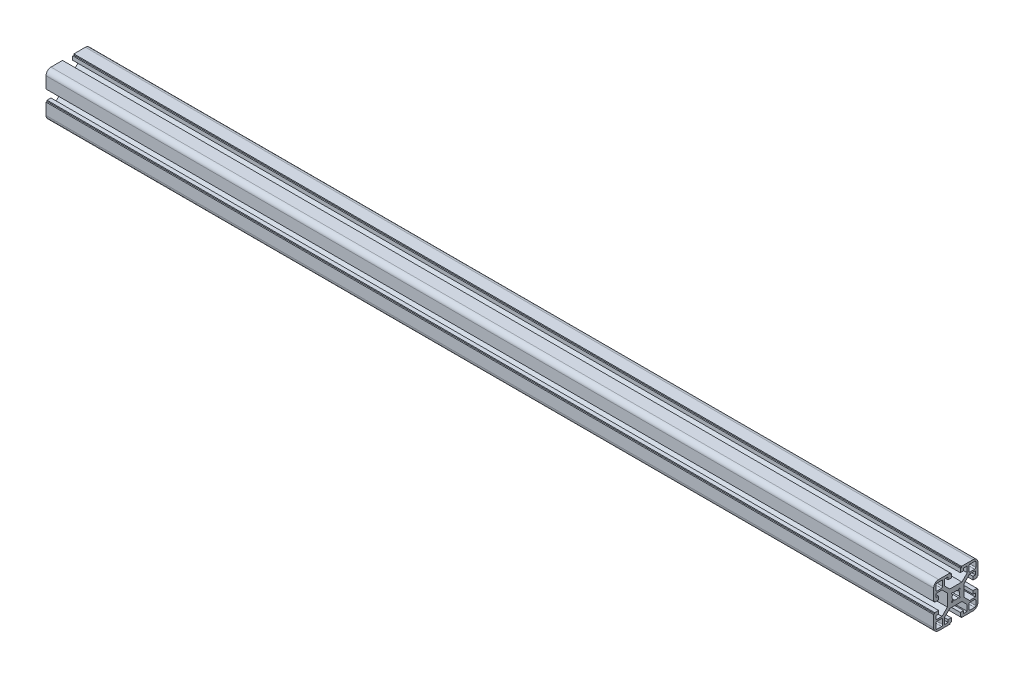
from build123d import *

# Parameters (mm, degrees)
EXTRUDE_1_DEPTH = 50
EXTRUDE_2_DEPTH = 800


with BuildPart() as part:
    # 草图1 → 凸台-拉伸1 (new body)
    with BuildSketch(Plane(origin=(0, 0, 0), x_dir=(0, 0, -1), z_dir=(1, 0, 0))):
        with BuildLine():
            Line((4.82004008, 19.27995992), (3.82004008, 19.27995992))
            Line((3.82004008, 19.27995992), (3.82004008, 15.77995992))
            Line((3.82004008, 15.77995992), (6.73639159, 15.77995992))
            Line((6.73639159, 15.77995992), (6.73639159, 18.02995992))
            Line((6.73639159, 18.02995992), (10.02004008, 18.02995992))
            Line((10.02004008, 18.02995992), (10.02004008, 12.70128026))
            Line((10.02004008, 12.70128026), (5.19871974, 7.87995992))
            Line((5.19871974, 7.87995992), (-5.75863958, 7.87995992))
            Line((-5.75863958, 7.87995992), (-10.57995992, 12.70128026))
            Line((-10.57995992, 12.70128026), (-10.57995992, 18.02995992))
            Line((-10.57995992, 18.02995992), (-7.29631143, 18.02995992))
            Line((-7.29631143, 18.02995992), (-7.29631143, 15.77995992))
            Line((-7.29631143, 15.77995992), (-4.37995992, 15.77995992))
            Line((-4.37995992, 15.77995992), (-4.37995992, 19.27995992))
            Line((-4.37995992, 19.27995992), (-5.37995992, 19.27995992))
            Line((-5.37995992, 19.27995992), (-5.37995992, 20.27995992))
            Line((-5.37995992, 20.27995992), (-15.77995992, 20.27995992))
            ThreePointArc((-15.77995992, 20.27995992), (-18.961940435, 18.961940435), (-20.27995992, 15.77995992))
            Line((-20.27995992, 15.77995992), (-20.27995992, 5.37995992))
            Line((-20.27995992, 5.37995992), (-19.27995992, 5.37995992))
            Line((-19.27995992, 5.37995992), (-19.27995992, 4.37995992))
            Line((-19.27995992, 4.37995992), (-15.77995992, 4.37995992))
            Line((-15.77995992, 4.37995992), (-15.77995992, 7.29631143))
            Line((-15.77995992, 7.29631143), (-18.02995992, 7.29631143))
            Line((-18.02995992, 7.29631143), (-18.02995992, 10.57995992))
            Line((-18.02995992, 10.57995992), (-12.70128026, 10.57995992))
            Line((-12.70128026, 10.57995992), (-7.87995992, 5.75863958))
            Line((-7.87995992, 5.75863958), (-7.87995992, -5.19871974))
            Line((-7.87995992, -5.19871974), (-12.70128026, -10.02004008))
            Line((-12.70128026, -10.02004008), (-18.02995992, -10.02004008))
            Line((-18.02995992, -10.02004008), (-18.02995992, -6.73639159))
            Line((-18.02995992, -6.73639159), (-15.77995992, -6.73639159))
            Line((-15.77995992, -6.73639159), (-15.77995992, -3.82004008))
            Line((-15.77995992, -3.82004008), (-19.27995992, -3.82004008))
            Line((-19.27995992, -3.82004008), (-19.27995992, -4.82004008))
            Line((-19.27995992, -4.82004008), (-20.27995992, -4.82004008))
            Line((-20.27995992, -4.82004008), (-20.27995992, -15.22004008))
            ThreePointArc((-20.27995992, -15.22004008), (-18.961940435, -18.402020595), (-15.77995992, -19.72004008))
            Line((-15.77995992, -19.72004008), (-5.37995992, -19.72004008))
            Line((-5.37995992, -19.72004008), (-5.37995992, -18.72004008))
            Line((-5.37995992, -18.72004008), (-4.37995992, -18.72004008))
            Line((-4.37995992, -18.72004008), (-4.37995992, -15.22004008))
            Line((-4.37995992, -15.22004008), (-7.29631143, -15.22004008))
            Line((-7.29631143, -15.22004008), (-7.29631143, -17.47004008))
            Line((-7.29631143, -17.47004008), (-10.57995992, -17.47004008))
            Line((-10.57995992, -17.47004008), (-10.57995992, -12.14136042))
            Line((-10.57995992, -12.14136042), (-5.75863958, -7.32004008))
            Line((-5.75863958, -7.32004008), (5.19871974, -7.32004008))
            Line((5.19871974, -7.32004008), (10.02004008, -12.14136042))
            Line((10.02004008, -12.14136042), (10.02004008, -17.47004008))
            Line((10.02004008, -17.47004008), (6.73639159, -17.47004008))
            Line((6.73639159, -17.47004008), (6.73639159, -15.22004008))
            Line((6.73639159, -15.22004008), (3.82004008, -15.22004008))
            Line((3.82004008, -15.22004008), (3.82004008, -18.72004008))
            Line((3.82004008, -18.72004008), (4.82004008, -18.72004008))
            Line((4.82004008, -18.72004008), (4.82004008, -19.72004008))
            Line((4.82004008, -19.72004008), (15.22004008, -19.72004008))
            ThreePointArc((15.22004008, -19.72004008), (18.402020595, -18.402020595), (19.72004008, -15.22004008))
            Line((19.72004008, -15.22004008), (19.72004008, -4.82004008))
            Line((19.72004008, -4.82004008), (18.72004008, -4.82004008))
            Line((18.72004008, -4.82004008), (18.72004008, -3.82004008))
            Line((18.72004008, -3.82004008), (15.22004008, -3.82004008))
            Line((15.22004008, -3.82004008), (15.22004008, -6.73639159))
            Line((15.22004008, -6.73639159), (17.47004008, -6.73639159))
            Line((17.47004008, -6.73639159), (17.47004008, -10.02004008))
            Line((17.47004008, -10.02004008), (12.14136042, -10.02004008))
            Line((12.14136042, -10.02004008), (7.32004008, -5.19871974))
            Line((7.32004008, -5.19871974), (7.32004008, 5.75863958))
            Line((7.32004008, 5.75863958), (12.14136042, 10.57995992))
            Line((12.14136042, 10.57995992), (17.47004008, 10.57995992))
            Line((17.47004008, 10.57995992), (17.47004008, 7.29631143))
            Line((17.47004008, 7.29631143), (15.22004008, 7.29631143))
            Line((15.22004008, 7.29631143), (15.22004008, 4.37995992))
            Line((15.22004008, 4.37995992), (18.72004008, 4.37995992))
            Line((18.72004008, 4.37995992), (18.72004008, 5.37995992))
            Line((18.72004008, 5.37995992), (19.72004008, 5.37995992))
            Line((19.72004008, 5.37995992), (19.72004008, 15.77995992))
            ThreePointArc((19.72004008, 15.77995992), (18.402020595, 18.961940435), (15.22004008, 20.27995992))
            Line((15.22004008, 20.27995992), (4.82004008, 20.27995992))
            Line((4.82004008, 20.27995992), (4.82004008, 19.27995992))
        make_face()
        with BuildLine():
            Line((-13.07995992, -17.72004008), (-17.27995992, -17.72004008))
            ThreePointArc((-17.27995992, -17.72004008), (-17.987066701, -17.427146861), (-18.27995992, -16.72004008))
            Line((-18.27995992, -16.72004008), (-18.27995992, -12.52004008))
            ThreePointArc((-18.27995992, -12.52004008), (-17.987066701, -11.812933299), (-17.27995992, -11.52004008))
            Line((-17.27995992, -11.52004008), (-13.07995992, -11.52004008))
            ThreePointArc((-13.07995992, -11.52004008), (-12.372853139, -11.812933299), (-12.07995992, -12.52004008))
            Line((-12.07995992, -12.52004008), (-12.07995992, -16.72004008))
            ThreePointArc((-12.07995992, -16.72004008), (-12.372853139, -17.427146861), (-13.07995992, -17.72004008))
        make_face(mode=Mode.SUBTRACT)
        with BuildLine():
            Line((-17.27995992, 18.27995992), (-13.07995992, 18.27995992))
            ThreePointArc((-13.07995992, 18.27995992), (-12.372853139, 17.987066701), (-12.07995992, 17.27995992))
            Line((-12.07995992, 17.27995992), (-12.07995992, 13.07995992))
            ThreePointArc((-12.07995992, 13.07995992), (-12.372853139, 12.372853139), (-13.07995992, 12.07995992))
            Line((-13.07995992, 12.07995992), (-17.27995992, 12.07995992))
            ThreePointArc((-17.27995992, 12.07995992), (-17.987066701, 12.372853139), (-18.27995992, 13.07995992))
            Line((-18.27995992, 13.07995992), (-18.27995992, 17.27995992))
            ThreePointArc((-18.27995992, 17.27995992), (-17.987066701, 17.987066701), (-17.27995992, 18.27995992))
        make_face(mode=Mode.SUBTRACT)
        with BuildLine():
            Line((16.72004008, 12.07995992), (12.52004008, 12.07995992))
            ThreePointArc((12.52004008, 12.07995992), (11.812933299, 12.372853139), (11.52004008, 13.07995992))
            Line((11.52004008, 13.07995992), (11.52004008, 17.27995992))
            ThreePointArc((11.52004008, 17.27995992), (11.812933299, 17.987066701), (12.52004008, 18.27995992))
            Line((12.52004008, 18.27995992), (16.72004008, 18.27995992))
            ThreePointArc((16.72004008, 18.27995992), (17.427146861, 17.987066701), (17.72004008, 17.27995992))
            Line((17.72004008, 17.27995992), (17.72004008, 13.07995992))
            ThreePointArc((17.72004008, 13.07995992), (17.427146861, 12.372853139), (16.72004008, 12.07995992))
        make_face(mode=Mode.SUBTRACT)
        with BuildLine():
            Line((3.75045895, -3.04335217), (3.04335217, -3.75045895))
            Line((3.04335217, -3.75045895), (1.74451108, -2.45161786))
            ThreePointArc((1.74451108, -2.45161786), (-0.27995992, -3.12004008), (-2.30443092, -2.45161786))
            Line((-2.30443092, -2.45161786), (-3.60327201, -3.75045895))
            Line((-3.60327201, -3.75045895), (-4.31037879, -3.04335217))
            Line((-4.31037879, -3.04335217), (-3.0115377, -1.74451108))
            ThreePointArc((-3.0115377, -1.74451108), (-3.67995992, 0.27995992), (-3.0115377, 2.30443092))
            Line((-3.0115377, 2.30443092), (-4.31037879, 3.60327201))
            Line((-4.31037879, 3.60327201), (-3.60327201, 4.31037879))
            Line((-3.60327201, 4.31037879), (-2.30443092, 3.0115377))
            ThreePointArc((-2.30443092, 3.0115377), (-0.27995992, 3.67995992), (1.74451108, 3.0115377))
            Line((1.74451108, 3.0115377), (3.04335217, 4.31037879))
            Line((3.04335217, 4.31037879), (3.75045895, 3.60327201))
            Line((3.75045895, 3.60327201), (2.45161786, 2.30443092))
            ThreePointArc((2.45161786, 2.30443092), (3.12004008, 0.27995992), (2.45161786, -1.74451108))
            Line((2.45161786, -1.74451108), (3.75045895, -3.04335217))
        make_face(mode=Mode.SUBTRACT)
        with BuildLine():
            Line((17.72004008, -12.52004008), (17.72004008, -16.72004008))
            ThreePointArc((17.72004008, -16.72004008), (17.427146861, -17.427146861), (16.72004008, -17.72004008))
            Line((16.72004008, -17.72004008), (12.52004008, -17.72004008))
            ThreePointArc((12.52004008, -17.72004008), (11.812933299, -17.427146861), (11.52004008, -16.72004008))
            Line((11.52004008, -16.72004008), (11.52004008, -12.52004008))
            ThreePointArc((11.52004008, -12.52004008), (11.812933299, -11.812933299), (12.52004008, -11.52004008))
            Line((12.52004008, -11.52004008), (16.72004008, -11.52004008))
            ThreePointArc((16.72004008, -11.52004008), (17.427146861, -11.812933299), (17.72004008, -12.52004008))
        make_face(mode=Mode.SUBTRACT)
    extrude(amount=-EXTRUDE_1_DEPTH)

    # 草图2 → 凸台-拉伸2 (add)
    with BuildSketch(Plane(origin=(0, 0, 0), x_dir=(0, 0, -1), z_dir=(1, 0, 0))):
        with BuildLine():
            Line((19.72004008, 5.37995992), (19.72004008, 15.77995992))
            ThreePointArc((19.72004008, 15.77995992), (18.402020595, 18.961940435), (15.22004008, 20.27995992))
            Line((15.22004008, 20.27995992), (4.82004008, 20.27995992))
            Line((4.82004008, 20.27995992), (4.82004008, 19.27995992))
            Line((4.82004008, 19.27995992), (3.82004008, 19.27995992))
            Line((3.82004008, 19.27995992), (3.82004008, 15.77995992))
            Line((3.82004008, 15.77995992), (6.73639159, 15.77995992))
            Line((6.73639159, 15.77995992), (6.73639159, 18.02995992))
            Line((6.73639159, 18.02995992), (10.02004008, 18.02995992))
            Line((10.02004008, 18.02995992), (10.02004008, 12.70128026))
            Line((10.02004008, 12.70128026), (5.19871974, 7.87995992))
            Line((5.19871974, 7.87995992), (-5.75863958, 7.87995992))
            Line((-5.75863958, 7.87995992), (-10.57995992, 12.70128026))
            Line((-10.57995992, 12.70128026), (-10.57995992, 18.02995992))
            Line((-10.57995992, 18.02995992), (-7.29631143, 18.02995992))
            Line((-7.29631143, 18.02995992), (-7.29631143, 15.77995992))
            Line((-7.29631143, 15.77995992), (-4.37995992, 15.77995992))
            Line((-4.37995992, 15.77995992), (-4.37995992, 19.27995992))
            Line((-4.37995992, 19.27995992), (-5.37995992, 19.27995992))
            Line((-5.37995992, 19.27995992), (-5.37995992, 20.27995992))
            Line((-5.37995992, 20.27995992), (-15.77995992, 20.27995992))
            ThreePointArc((-15.77995992, 20.27995992), (-18.961940435, 18.961940435), (-20.27995992, 15.77995992))
            Line((-20.27995992, 15.77995992), (-20.27995992, 5.37995992))
            Line((-20.27995992, 5.37995992), (-19.27995992, 5.37995992))
            Line((-19.27995992, 5.37995992), (-19.27995992, 4.37995992))
            Line((-19.27995992, 4.37995992), (-15.77995992, 4.37995992))
            Line((-15.77995992, 4.37995992), (-15.77995992, 7.29631143))
            Line((-15.77995992, 7.29631143), (-18.02995992, 7.29631143))
            Line((-18.02995992, 7.29631143), (-18.02995992, 10.57995992))
            Line((-18.02995992, 10.57995992), (-12.70128026, 10.57995992))
            Line((-12.70128026, 10.57995992), (-7.87995992, 5.75863958))
            Line((-7.87995992, 5.75863958), (-7.87995992, -5.19871974))
            Line((-7.87995992, -5.19871974), (-12.70128026, -10.02004008))
            Line((-12.70128026, -10.02004008), (-18.02995992, -10.02004008))
            Line((-18.02995992, -10.02004008), (-18.02995992, -6.73639159))
            Line((-18.02995992, -6.73639159), (-15.77995992, -6.73639159))
            Line((-15.77995992, -6.73639159), (-15.77995992, -3.82004008))
            Line((-15.77995992, -3.82004008), (-19.27995992, -3.82004008))
            Line((-19.27995992, -3.82004008), (-19.27995992, -4.82004008))
            Line((-19.27995992, -4.82004008), (-20.27995992, -4.82004008))
            Line((-20.27995992, -4.82004008), (-20.27995992, -15.22004008))
            ThreePointArc((-20.27995992, -15.22004008), (-18.961940435, -18.402020595), (-15.77995992, -19.72004008))
            Line((-15.77995992, -19.72004008), (-5.37995992, -19.72004008))
            Line((-5.37995992, -19.72004008), (-5.37995992, -18.72004008))
            Line((-5.37995992, -18.72004008), (-4.37995992, -18.72004008))
            Line((-4.37995992, -18.72004008), (-4.37995992, -15.22004008))
            Line((-4.37995992, -15.22004008), (-7.29631143, -15.22004008))
            Line((-7.29631143, -15.22004008), (-7.29631143, -17.47004008))
            Line((-7.29631143, -17.47004008), (-10.57995992, -17.47004008))
            Line((-10.57995992, -17.47004008), (-10.57995992, -12.14136042))
            Line((-10.57995992, -12.14136042), (-5.75863958, -7.32004008))
            Line((-5.75863958, -7.32004008), (5.19871974, -7.32004008))
            Line((5.19871974, -7.32004008), (10.02004008, -12.14136042))
            Line((10.02004008, -12.14136042), (10.02004008, -17.47004008))
            Line((10.02004008, -17.47004008), (6.73639159, -17.47004008))
            Line((6.73639159, -17.47004008), (6.73639159, -15.22004008))
            Line((6.73639159, -15.22004008), (3.82004008, -15.22004008))
            Line((3.82004008, -15.22004008), (3.82004008, -18.72004008))
            Line((3.82004008, -18.72004008), (4.82004008, -18.72004008))
            Line((4.82004008, -18.72004008), (4.82004008, -19.72004008))
            Line((4.82004008, -19.72004008), (15.22004008, -19.72004008))
            ThreePointArc((15.22004008, -19.72004008), (18.402020595, -18.402020595), (19.72004008, -15.22004008))
            Line((19.72004008, -15.22004008), (19.72004008, -4.82004008))
            Line((19.72004008, -4.82004008), (18.72004008, -4.82004008))
            Line((18.72004008, -4.82004008), (18.72004008, -3.82004008))
            Line((18.72004008, -3.82004008), (15.22004008, -3.82004008))
            Line((15.22004008, -3.82004008), (15.22004008, -6.73639159))
            Line((15.22004008, -6.73639159), (17.47004008, -6.73639159))
            Line((17.47004008, -6.73639159), (17.47004008, -10.02004008))
            Line((17.47004008, -10.02004008), (12.14136042, -10.02004008))
            Line((12.14136042, -10.02004008), (7.32004008, -5.19871974))
            Line((7.32004008, -5.19871974), (7.32004008, 5.75863958))
            Line((7.32004008, 5.75863958), (12.14136042, 10.57995992))
            Line((12.14136042, 10.57995992), (17.47004008, 10.57995992))
            Line((17.47004008, 10.57995992), (17.47004008, 7.29631143))
            Line((17.47004008, 7.29631143), (15.22004008, 7.29631143))
            Line((15.22004008, 7.29631143), (15.22004008, 4.37995992))
            Line((15.22004008, 4.37995992), (18.72004008, 4.37995992))
            Line((18.72004008, 4.37995992), (18.72004008, 5.37995992))
            Line((18.72004008, 5.37995992), (19.72004008, 5.37995992))
        make_face()
        with BuildLine():
            Line((-17.27995992, -17.72004008), (-13.07995992, -17.72004008))
            ThreePointArc((-13.07995992, -17.72004008), (-12.372853139, -17.427146861), (-12.07995992, -16.72004008))
            Line((-12.07995992, -16.72004008), (-12.07995992, -12.52004008))
            ThreePointArc((-12.07995992, -12.52004008), (-12.372853139, -11.812933299), (-13.07995992, -11.52004008))
            Line((-13.07995992, -11.52004008), (-17.27995992, -11.52004008))
            ThreePointArc((-17.27995992, -11.52004008), (-17.987066701, -11.812933299), (-18.27995992, -12.52004008))
            Line((-18.27995992, -12.52004008), (-18.27995992, -16.72004008))
            ThreePointArc((-18.27995992, -16.72004008), (-17.987066701, -17.427146861), (-17.27995992, -17.72004008))
        make_face(mode=Mode.SUBTRACT)
        with BuildLine():
            Line((-13.07995992, 18.27995992), (-17.27995992, 18.27995992))
            ThreePointArc((-17.27995992, 18.27995992), (-17.987066701, 17.987066701), (-18.27995992, 17.27995992))
            Line((-18.27995992, 17.27995992), (-18.27995992, 13.07995992))
            ThreePointArc((-18.27995992, 13.07995992), (-17.987066701, 12.372853139), (-17.27995992, 12.07995992))
            Line((-17.27995992, 12.07995992), (-13.07995992, 12.07995992))
            ThreePointArc((-13.07995992, 12.07995992), (-12.372853139, 12.372853139), (-12.07995992, 13.07995992))
            Line((-12.07995992, 13.07995992), (-12.07995992, 17.27995992))
            ThreePointArc((-12.07995992, 17.27995992), (-12.372853139, 17.987066701), (-13.07995992, 18.27995992))
        make_face(mode=Mode.SUBTRACT)
        with BuildLine():
            Line((11.52004008, 17.27995992), (11.52004008, 13.07995992))
            ThreePointArc((11.52004008, 13.07995992), (11.812933299, 12.372853139), (12.52004008, 12.07995992))
            Line((12.52004008, 12.07995992), (16.72004008, 12.07995992))
            ThreePointArc((16.72004008, 12.07995992), (17.427146861, 12.372853139), (17.72004008, 13.07995992))
            Line((17.72004008, 13.07995992), (17.72004008, 17.27995992))
            ThreePointArc((17.72004008, 17.27995992), (17.427146861, 17.987066701), (16.72004008, 18.27995992))
            Line((16.72004008, 18.27995992), (12.52004008, 18.27995992))
            ThreePointArc((12.52004008, 18.27995992), (11.812933299, 17.987066701), (11.52004008, 17.27995992))
        make_face(mode=Mode.SUBTRACT)
        with BuildLine():
            Line((11.52004008, -12.52004008), (11.52004008, -16.72004008))
            ThreePointArc((11.52004008, -16.72004008), (11.812933299, -17.427146861), (12.52004008, -17.72004008))
            Line((12.52004008, -17.72004008), (16.72004008, -17.72004008))
            ThreePointArc((16.72004008, -17.72004008), (17.427146861, -17.427146861), (17.72004008, -16.72004008))
            Line((17.72004008, -16.72004008), (17.72004008, -12.52004008))
            ThreePointArc((17.72004008, -12.52004008), (17.427146861, -11.812933299), (16.72004008, -11.52004008))
            Line((16.72004008, -11.52004008), (12.52004008, -11.52004008))
            ThreePointArc((12.52004008, -11.52004008), (11.812933299, -11.812933299), (11.52004008, -12.52004008))
        make_face(mode=Mode.SUBTRACT)
        with BuildLine():
            Line((-4.31037879, 3.60327201), (-3.0115377, 2.30443092))
            ThreePointArc((-3.0115377, 2.30443092), (-3.67995992, 0.27995992), (-3.0115377, -1.74451108))
            Line((-3.0115377, -1.74451108), (-4.31037879, -3.04335217))
            Line((-4.31037879, -3.04335217), (-3.60327201, -3.75045895))
            Line((-3.60327201, -3.75045895), (-2.30443092, -2.45161786))
            ThreePointArc((-2.30443092, -2.45161786), (-0.27995992, -3.12004008), (1.74451108, -2.45161786))
            Line((1.74451108, -2.45161786), (3.04335217, -3.75045895))
            Line((3.04335217, -3.75045895), (3.75045895, -3.04335217))
            Line((3.75045895, -3.04335217), (2.45161786, -1.74451108))
            ThreePointArc((2.45161786, -1.74451108), (3.12004008, 0.27995992), (2.45161786, 2.30443092))
            Line((2.45161786, 2.30443092), (3.75045895, 3.60327201))
            Line((3.75045895, 3.60327201), (3.04335217, 4.31037879))
            Line((3.04335217, 4.31037879), (1.74451108, 3.0115377))
            ThreePointArc((1.74451108, 3.0115377), (-0.27995992, 3.67995992), (-2.30443092, 3.0115377))
            Line((-2.30443092, 3.0115377), (-3.60327201, 4.31037879))
            Line((-3.60327201, 4.31037879), (-4.31037879, 3.60327201))
        make_face(mode=Mode.SUBTRACT)
    extrude(amount=-EXTRUDE_2_DEPTH)


solid = part.part
